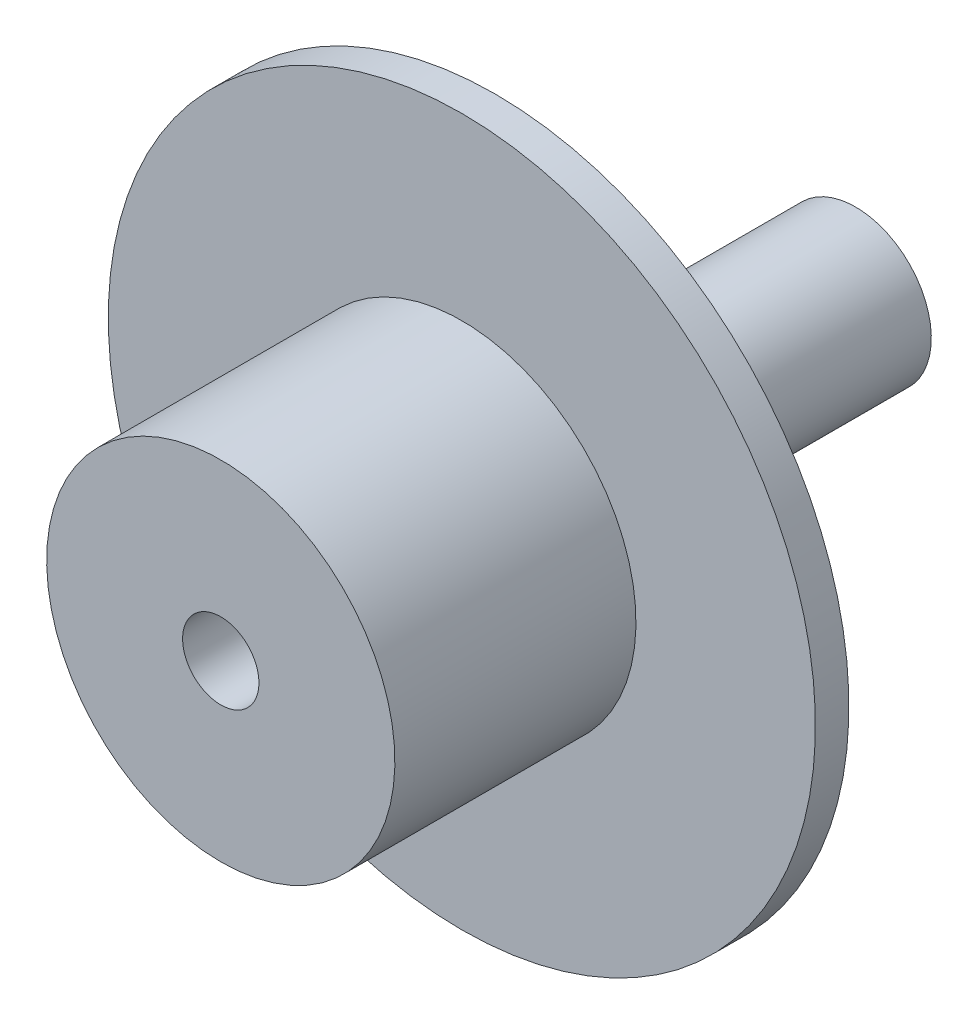
from build123d import *

# Parameters (mm, degrees)
SKETCH2_R          = 28.5
CUT_EXTRUDE1_DEPTH = 604.380476979


with BuildPart() as part:
    # Sketch1 → Revolve1 (revolve)
    with BuildSketch(Plane(origin=(0, 0, 0), x_dir=(0, 0, -1), z_dir=(1, 0, 0)), mode=Mode.PRIVATE) as revolve1_sk:
        Polygon((0, 0), (0, 130), (180, 130), (180, 264), (205, 264), (205, 56.5), (474, 56.5), (474, 0), align=None)
    revolve(revolve1_sk.sketch.rotate(Axis((0, 0, 0), (0, 0, -1)), 180), axis=Axis((0, 0, 0), (0, 0, -1)))

    # Sketch2 → Cut-Extrude1 (cut, through all)
    with BuildSketch(Plane.XY):
        Circle(SKETCH2_R)
    extrude(amount=-CUT_EXTRUDE1_DEPTH, mode=Mode.SUBTRACT)


solid = part.part
